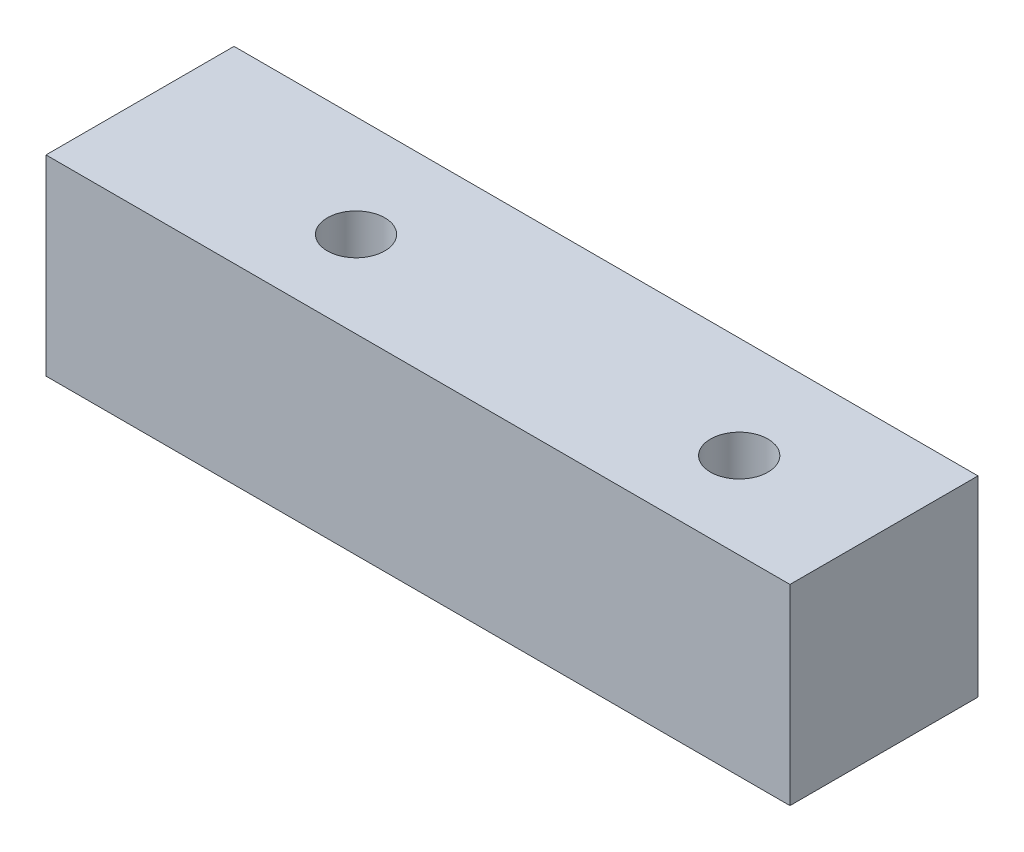
from build123d import *

# Parameters (mm, degrees)
SKETCH_1_W      = 38.83160715
SKETCH_1_H      = 9.814539481
SKETCH_1_R      = 1.5
EXTRUDE_1_DEPTH = 10


with BuildPart() as part:
    # 草图1 → 凸台-拉伸1 (new body)
    with BuildSketch(Plane(origin=(0, 0, 0), x_dir=(1, 0, 0), z_dir=(0, 1, 0))):
        with Locations((-7.25364565, 2.157738155)):
            Rectangle(SKETCH_1_W, SKETCH_1_H)
        with Locations(Location((-14.986457872, 1.750468415, 0), (0, 0, 270))):
            Circle(SKETCH_1_R, mode=Mode.SUBTRACT)
        with Locations(Location((5.013542128, 1.750468415, 0), (0, 0, 270))):
            Circle(SKETCH_1_R, mode=Mode.SUBTRACT)
    extrude(amount=EXTRUDE_1_DEPTH)


solid = part.part
